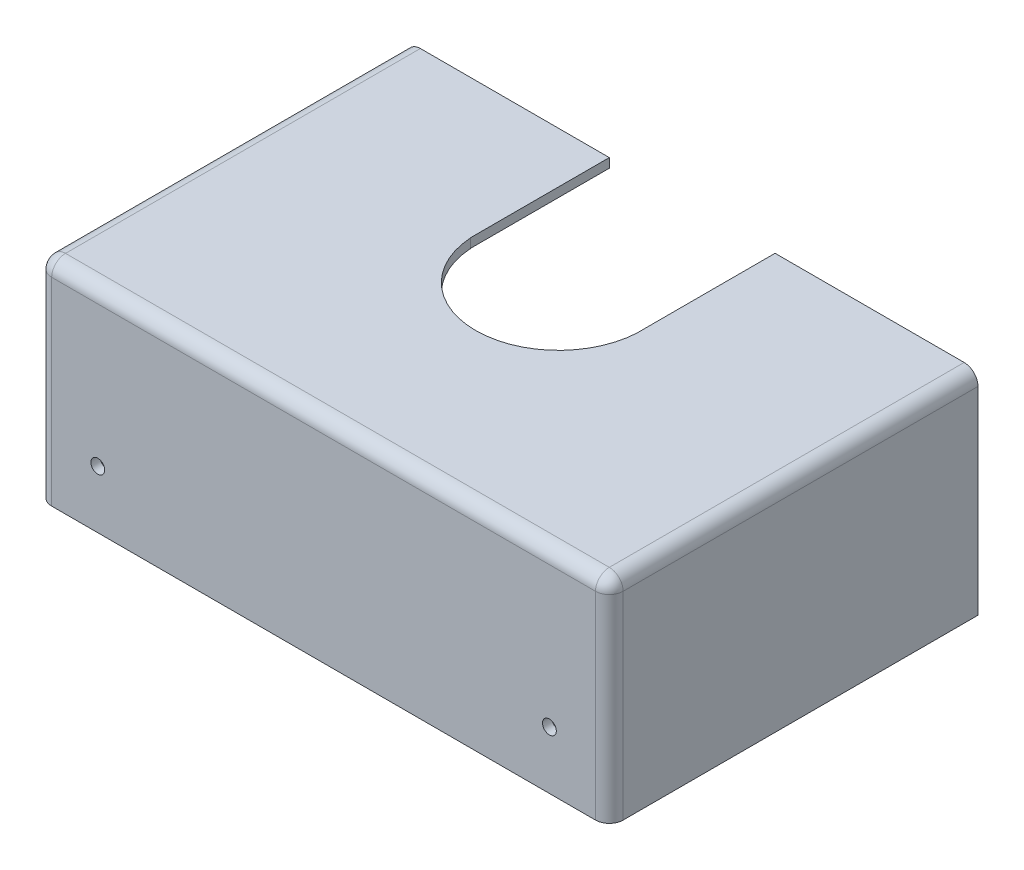
from build123d import *

# Parameters (mm, degrees)
SKETCH1_W             = 124
SKETCH1_H             = 46
BOSS_EXTRUDE1_DEPTH   = 80
SKETCH2_W             = 120
SKETCH2_H             = 44
CUT_EXTRUDE1_DEPTH    = 78
SKETCH3_R             = 18
CUT_EXTRUDE2_DEPTH    = 78
SKETCH4_W             = 35.964383321
SKETCH4_H             = 30.131782619
CUT_EXTRUDE3_DEPTH    = 78
FILLET1_R             = 1
FILLET2_R             = 1
FILLET3_R             = 3
F_3_0MM_DOWEL_HOLE1_D = 3


with BuildPart() as part:
    # Sketch1 → Boss-Extrude1 (new body)
    with BuildSketch(Plane.XY):
        with Locations((62, 23)):
            Rectangle(SKETCH1_W, SKETCH1_H)
    extrude(amount=BOSS_EXTRUDE1_DEPTH)

    # Sketch2 → Cut-Extrude1 (cut)
    with BuildSketch(Plane(origin=(0, 0, 0), x_dir=(-1, 0, 0), z_dir=(0, 0, -1))):
        with Locations((-62, 22)):
            Rectangle(SKETCH2_W, SKETCH2_H)
    extrude(amount=-CUT_EXTRUDE1_DEPTH, mode=Mode.SUBTRACT)

    # Sketch3 → Cut-Extrude2 (cut)
    with BuildSketch(Plane(origin=(0, 46, 0), x_dir=(1, 0, 0), z_dir=(0, 1, 0))):
        with Locations(Location((62, -29, 0), (0, 0, 270))):
            Circle(SKETCH3_R)
    extrude(amount=-CUT_EXTRUDE2_DEPTH, mode=Mode.SUBTRACT)

    # Sketch4 → Cut-Extrude3 (cut)
    with BuildSketch(Plane(origin=(0, 46, 0), x_dir=(1, 0, 0), z_dir=(0, 1, 0))):
        with Locations((61.98219166, -15.06589131)):
            Rectangle(SKETCH4_W, SKETCH4_H)
    extrude(amount=-CUT_EXTRUDE3_DEPTH, mode=Mode.SUBTRACT)

    # Fillet1
    fillet1_edges = [part.edges().sort_by_distance(p)[0] for p in [
        (62, 44, 78),
        (2, 22, 78),
        (2, 44, 39),
    ]]
    fillet(fillet1_edges, radius=FILLET1_R)

    # Fillet2
    fillet2_edges = [part.edges().sort_by_distance(p)[0] for p in [
        (122, 21.5, 78),
        (122, 44, 38.5),
        (122, 43.707106781, 77.707106781),
    ]]
    fillet(fillet2_edges, radius=FILLET2_R)

    # Fillet3
    fillet3_edges = [part.edges().sort_by_distance(p)[0] for p in [
        (124, 23, 80),
        (62, 46, 80),
        (0, 23, 80),
        (0, 46, 40),
        (124, 46, 40),
    ]]
    fillet(fillet3_edges, radius=FILLET3_R)

    # Ø3.0mm Dowel Hole1 (through all)
    with Locations(Plane(origin=(13, 12.5, 80), x_dir=(1, 0, 0), z_dir=(0, 0, 1))):
        with Locations((0, 0), (98, 0)):
            Hole(F_3_0MM_DOWEL_HOLE1_D / 2)


solid = part.part
